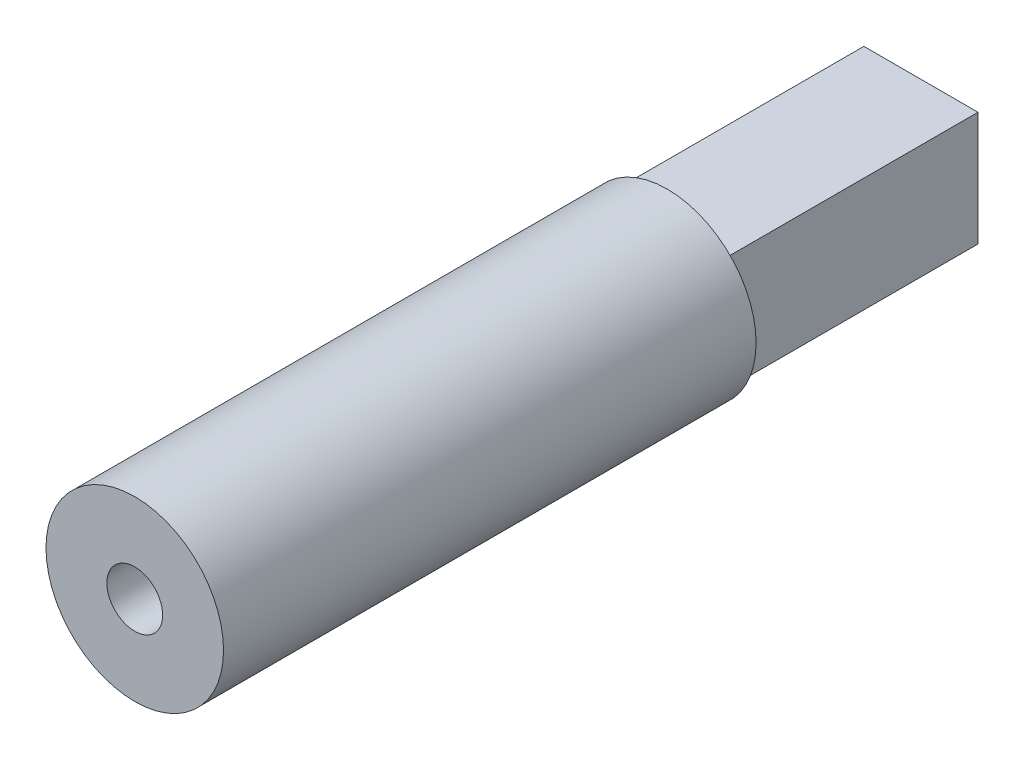
from build123d import *

# Parameters (mm, degrees)
SKETCH2_R           = 3.5
BOSS_EXTRUDE1_DEPTH = 31
SKETCH4_R           = 3.5
SKETCH4_W           = 4.5
SKETCH4_H           = 4.5
CUT_EXTRUDE1_DEPTH  = 10
SKETCH7_R           = 1.1
CUT_EXTRUDE2_DEPTH  = 6


with BuildPart() as part:
    # Sketch2 → Boss-Extrude1 (new body)
    with BuildSketch(Plane.XY):
        Circle(SKETCH2_R)
    extrude(amount=BOSS_EXTRUDE1_DEPTH)

    # Sketch4 → Cut-Extrude1 (cut)
    with BuildSketch(Plane(origin=(0, 0, 0), x_dir=(-1, 0, 0), z_dir=(0, 0, -1))):
        Circle(SKETCH4_R)
        Rectangle(SKETCH4_W, SKETCH4_H, mode=Mode.SUBTRACT)
    extrude(amount=-CUT_EXTRUDE1_DEPTH, mode=Mode.SUBTRACT)

    # Sketch7 → Cut-Extrude2 (cut)
    with BuildSketch(Plane.XY.offset(31)):
        Circle(SKETCH7_R)
    extrude(amount=-CUT_EXTRUDE2_DEPTH, mode=Mode.SUBTRACT)


solid = part.part
